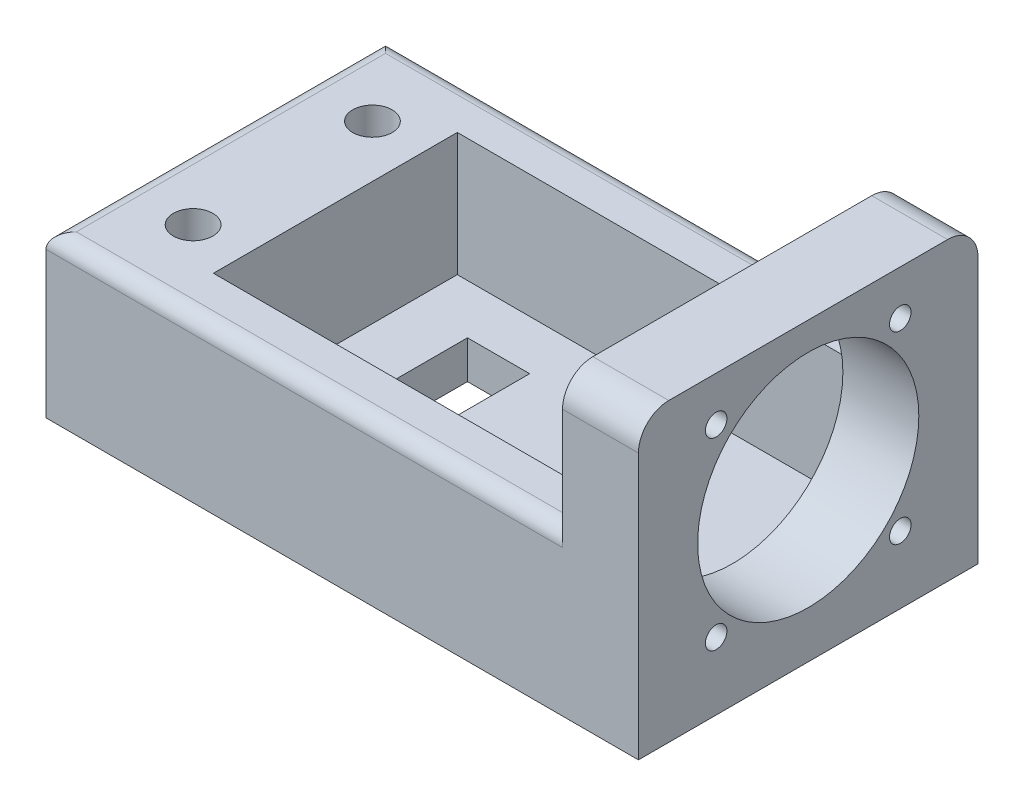
from build123d import *

# Parameters (mm, degrees)
SKETCH1_W           = 43.20032
SKETCH1_H           = 28.39974
BOSS_EXTRUDE1_DEPTH = 13.4747
SKETCH2_W           = 33.20034
SKETCH2_H           = 20.39874
CUT_EXTRUDE1_DEPTH  = 10.2997
SKETCH3_W           = 5.19938
SKETCH3_H           = 12.10056
CUT_EXTRUDE2_DEPTH  = 53.715241631
BOSS_EXTRUDE2_DEPTH = 6.35
SKETCH5_W           = 6.35
SKETCH5_H           = 28.39974
BOSS_EXTRUDE3_DEPTH = 21.59
SKETCH6_R           = 9.25
CUT_EXTRUDE3_DEPTH  = 25.4
SKETCH7_R           = 0.9
CUT_EXTRUDE4_DEPTH  = 25.4
FILLET1_R           = 2.54
FILLET2_R           = 1.27
SKETCH8_R           = 1.651
CUT_EXTRUDE5_DEPTH  = 25.4


with BuildPart() as part:
    # Sketch1 → Boss-Extrude1 (new body)
    with BuildSketch(Plane(origin=(0, 0, 0), x_dir=(1, 0, 0), z_dir=(0, 1, 0))):
        with Locations((21.60016, 14.19987)):
            Rectangle(SKETCH1_W, SKETCH1_H)
    extrude(amount=BOSS_EXTRUDE1_DEPTH)

    # Sketch2 → Cut-Extrude1 (cut)
    with BuildSketch(Plane(origin=(0, 13.4747, 0), x_dir=(1, 0, 0), z_dir=(0, 1, 0))):
        with Locations((26.60015, 14.19987)):
            Rectangle(SKETCH2_W, SKETCH2_H)
    extrude(amount=-CUT_EXTRUDE1_DEPTH, mode=Mode.SUBTRACT)

    # Sketch3 → Cut-Extrude2 (cut, through all)
    with BuildSketch(Plane(origin=(0, 3.175, 0), x_dir=(1, 0, 0), z_dir=(0, 1, 0))):
        with Locations((17.60093, 14.19987)):
            Rectangle(SKETCH3_W, SKETCH3_H)
    extrude(amount=-CUT_EXTRUDE2_DEPTH, mode=Mode.SUBTRACT)

    # Sketch4 → Boss-Extrude2 (add)
    with BuildSketch(Plane(origin=(43.20032, 0, 0), x_dir=(0, 0, -1), z_dir=(1, 0, 0))):
        Polygon((24.39924, 3.175), (4.0005, 3.175), (4.0005, 13.4747), (0, 13.4747), (0, 0), (28.39974, 0), (28.39974, 13.4747), (24.39924, 13.4747), align=None)
    extrude(amount=BOSS_EXTRUDE2_DEPTH)

    # Sketch5 → Boss-Extrude3 (add)
    with BuildSketch(Plane(origin=(0, 3.175, 0), x_dir=(1, 0, 0), z_dir=(0, 1, 0))):
        with Locations((46.37532, 14.19987)):
            Rectangle(SKETCH5_W, SKETCH5_H)
    extrude(amount=BOSS_EXTRUDE3_DEPTH)

    # Sketch6 → Cut-Extrude3 (cut)
    with BuildSketch(Plane(origin=(49.55032, 0, 0), x_dir=(0, 0, -1), z_dir=(1, 0, 0))):
        with Locations((14.19987, 13.177)):
            Circle(SKETCH6_R)
    extrude(amount=-CUT_EXTRUDE3_DEPTH, mode=Mode.SUBTRACT)

    # Sketch7 → Cut-Extrude4 (cut)
    with BuildSketch(Plane(origin=(49.55032, 0, 0), x_dir=(0, 0, -1), z_dir=(1, 0, 0))):
        with Locations((6.49987, 21.039)):
            Circle(SKETCH7_R)
        with Locations((21.89987, 21.039)):
            Circle(SKETCH7_R)
        with Locations((21.89987, 5.639)):
            Circle(SKETCH7_R)
        with Locations((6.49987, 5.639)):
            Circle(SKETCH7_R)
    extrude(amount=-CUT_EXTRUDE4_DEPTH, mode=Mode.SUBTRACT)

    # Fillet1
    fillet1_edges = [part.edges().sort_by_distance(p)[0] for p in [
        (46.37532, 24.765, -28.39974),
        (46.37532, 24.765, 0),
    ]]
    fillet(fillet1_edges, radius=FILLET1_R)

    # Fillet2
    fillet2_edges = [part.edges().sort_by_distance(p)[0] for p in [
        (21.60016, 13.4747, -28.39974),
        (0, 13.4747, -14.19987),
        (21.60016, 13.4747, 0),
    ]]
    fillet(fillet2_edges, radius=FILLET2_R)

    # Sketch8 → Cut-Extrude5 (cut)
    with BuildSketch(Plane(origin=(0, 13.4747, 0), x_dir=(1, 0, 0), z_dir=(0, 1, 0))):
        with Locations(Location((5.63499, 21.6675, 0), (0, 0, 270))):
            Circle(SKETCH8_R)
        with Locations(Location((5.63499, 6.6675, 0), (0, 0, 270))):
            Circle(SKETCH8_R)
    extrude(amount=-CUT_EXTRUDE5_DEPTH, mode=Mode.SUBTRACT)


solid = part.part
